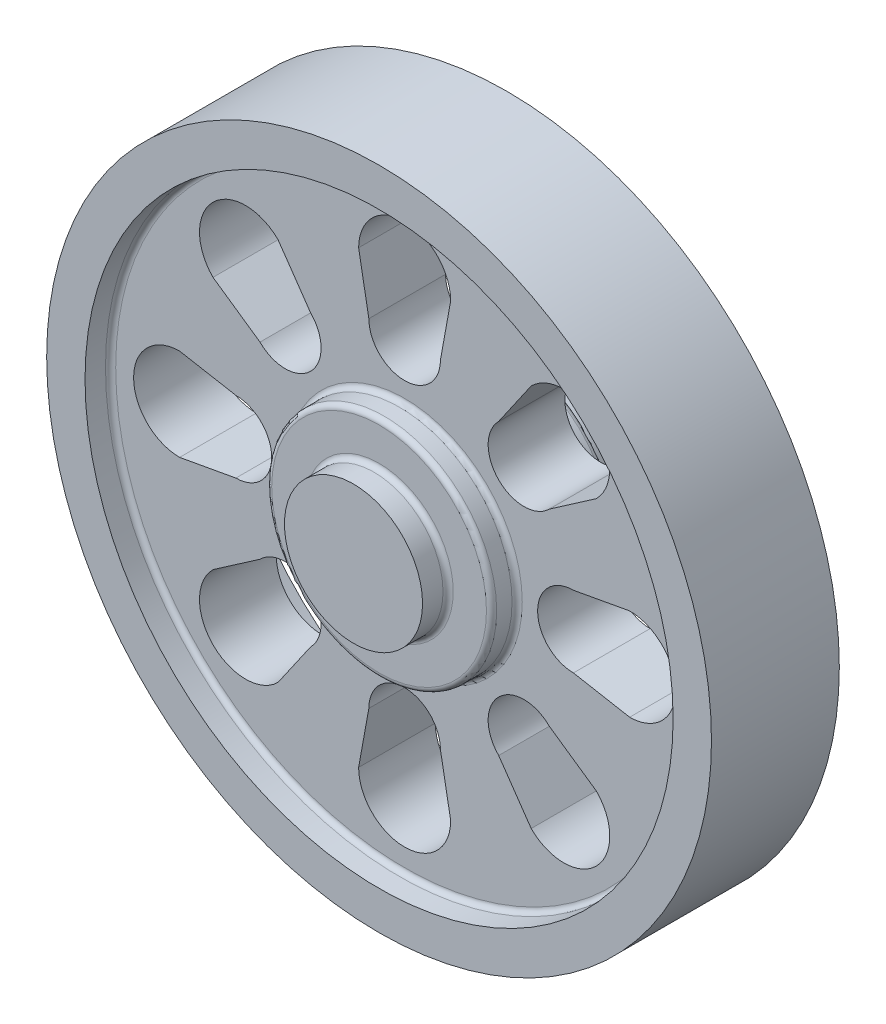
from build123d import *

# Parameters (mm, degrees)
SKETCH1_R                = 6.5
BOSS_EXTRUDE1_DEPTH      = 2.5
SKETCH2_R                = 5.75
CUT_EXTRUDE1_DEPTH       = 0.5
CUT_EXTRUDE2_START       = -0.5
SKETCH3_R                = 5.75
CUT_EXTRUDE2_DEPTH       = 0.5
BOSS_EXTRUDE2_DEPTH      = 0.5
BOSS_EXTRUDE2_DEPTH_BACK = 2
SKETCH4_R                = 2.2
CUT_EXTRUDE3_DEPTH       = 10.407443861
SKETCH6_R                = 1.35
BOSS_EXTRUDE3_DEPTH      = 0.5
BOSS_EXTRUDE4_START      = -5.5
SKETCH7_R                = 1.35
BOSS_EXTRUDE4_DEPTH      = 2.5
FILLET5_R                = 0.1
FILLET6_R                = 0.1


with BuildPart() as part:
    # Sketch1 → Boss-Extrude1 (new body)
    with BuildSketch(Plane.XY):
        Circle(SKETCH1_R)
    extrude(amount=BOSS_EXTRUDE1_DEPTH)

    # Sketch2 → Cut-Extrude1 (cut)
    with BuildSketch(Plane.XY.offset(2.5)):
        Circle(SKETCH2_R)
    extrude(amount=-CUT_EXTRUDE1_DEPTH, mode=Mode.SUBTRACT)

    # Sketch3 → Cut-Extrude2 (cut)
    with BuildSketch(Plane(origin=(0, 0, 0), x_dir=(-1, 0, 0), z_dir=(0, 0, -1)).offset(CUT_EXTRUDE2_START)):
        with Locations(Location((0, 0, 0), (0, 0, 180))):
            Circle(SKETCH3_R)
    extrude(amount=CUT_EXTRUDE2_DEPTH, mode=Mode.SUBTRACT)

    # Sketch4 → Boss-Extrude2 (add, two sides: drawn at the far end of the back side and taken through both)
    with BuildSketch(Plane.XY.offset(2).offset(-BOSS_EXTRUDE2_DEPTH_BACK)):
        Circle(SKETCH4_R)
    extrude(amount=BOSS_EXTRUDE2_DEPTH + BOSS_EXTRUDE2_DEPTH_BACK)

    # Sketch5 → Cut-Extrude3 (cut, through all)
    with BuildSketch(Plane.XY.offset(2)):
        with BuildLine():
            Line((-0.9, 4.4), (-0.7, 3.3))
            ThreePointArc((-0.7, 3.3), (0, 2.6), (0.7, 3.3))
            Line((0.7, 3.3), (0.9, 4.4))
            ThreePointArc((0.9, 4.4), (0, 5.3), (-0.9, 4.4))
        make_face()
        with BuildLine():
            Line((3.74766594, 2.474873734), (2.828427125, 1.838477631))
            ThreePointArc((2.828427125, 1.838477631), (1.838477631, 1.838477631), (1.838477631, 2.828427125))
            Line((1.838477631, 2.828427125), (2.474873734, 3.74766594))
            ThreePointArc((2.474873734, 3.74766594), (3.74766594, 3.74766594), (3.74766594, 2.474873734))
        make_face()
        with BuildLine():
            Line((4.4, -0.9), (3.3, -0.7))
            ThreePointArc((3.3, -0.7), (2.6, 0), (3.3, 0.7))
            Line((3.3, 0.7), (4.4, 0.9))
            ThreePointArc((4.4, 0.9), (5.3, 0), (4.4, -0.9))
        make_face()
        with BuildLine():
            Line((2.474873734, -3.74766594), (1.838477631, -2.828427125))
            ThreePointArc((1.838477631, -2.828427125), (1.838477631, -1.838477631), (2.828427125, -1.838477631))
            Line((2.828427125, -1.838477631), (3.74766594, -2.474873734))
            ThreePointArc((3.74766594, -2.474873734), (3.74766594, -3.74766594), (2.474873734, -3.74766594))
        make_face()
        with BuildLine():
            Line((-0.9, -4.4), (-0.7, -3.3))
            ThreePointArc((-0.7, -3.3), (0, -2.6), (0.7, -3.3))
            Line((0.7, -3.3), (0.9, -4.4))
            ThreePointArc((0.9, -4.4), (0, -5.3), (-0.9, -4.4))
        make_face()
        with BuildLine():
            Line((-3.74766594, -2.474873734), (-2.828427125, -1.838477631))
            ThreePointArc((-2.828427125, -1.838477631), (-1.838477631, -1.838477631), (-1.838477631, -2.828427125))
            Line((-1.838477631, -2.828427125), (-2.474873734, -3.74766594))
            ThreePointArc((-2.474873734, -3.74766594), (-3.74766594, -3.74766594), (-3.74766594, -2.474873734))
        make_face()
        with BuildLine():
            Line((-4.4, 0.9), (-3.3, 0.7))
            ThreePointArc((-3.3, 0.7), (-2.6, 0), (-3.3, -0.7))
            Line((-3.3, -0.7), (-4.4, -0.9))
            ThreePointArc((-4.4, -0.9), (-5.3, 0), (-4.4, 0.9))
        make_face()
        with BuildLine():
            Line((-2.474873734, 3.74766594), (-1.838477631, 2.828427125))
            ThreePointArc((-1.838477631, 2.828427125), (-1.838477631, 1.838477631), (-2.828427125, 1.838477631))
            Line((-2.828427125, 1.838477631), (-3.74766594, 2.474873734))
            ThreePointArc((-3.74766594, 2.474873734), (-3.74766594, 3.74766594), (-2.474873734, 3.74766594))
        make_face()
    extrude(amount=-CUT_EXTRUDE3_DEPTH, mode=Mode.SUBTRACT)

    # Sketch6 → Boss-Extrude3 (add)
    with BuildSketch(Plane.XY.offset(2.5)):
        Circle(SKETCH6_R)
    extrude(amount=BOSS_EXTRUDE3_DEPTH)

    # Sketch7 → Boss-Extrude4 (add)
    with BuildSketch(Plane.XY.offset(3).offset(BOSS_EXTRUDE4_START)):
        Circle(SKETCH7_R)
    extrude(amount=BOSS_EXTRUDE4_DEPTH)

    # Fillet5
    fillet5_edges = [part.edges().sort_by_distance(p)[0] for p in [
        (-2.2, 0, 2),
        (-2.2, 0, 2.5),
        (-1.35, 0, 2.5),
        (-5.75, 0, 2),
    ]]
    fillet(fillet5_edges, radius=FILLET5_R)

    # Fillet6
    fillet6_edges = [part.edges().sort_by_distance(p)[0] for p in [
        (-5.75, 0, 0.5),
        (-2.2, 0, 0.5),
        (-2.2, 0, 0),
        (-1.35, 0, 0),
    ]]
    fillet(fillet6_edges, radius=FILLET6_R)


solid = part.part
